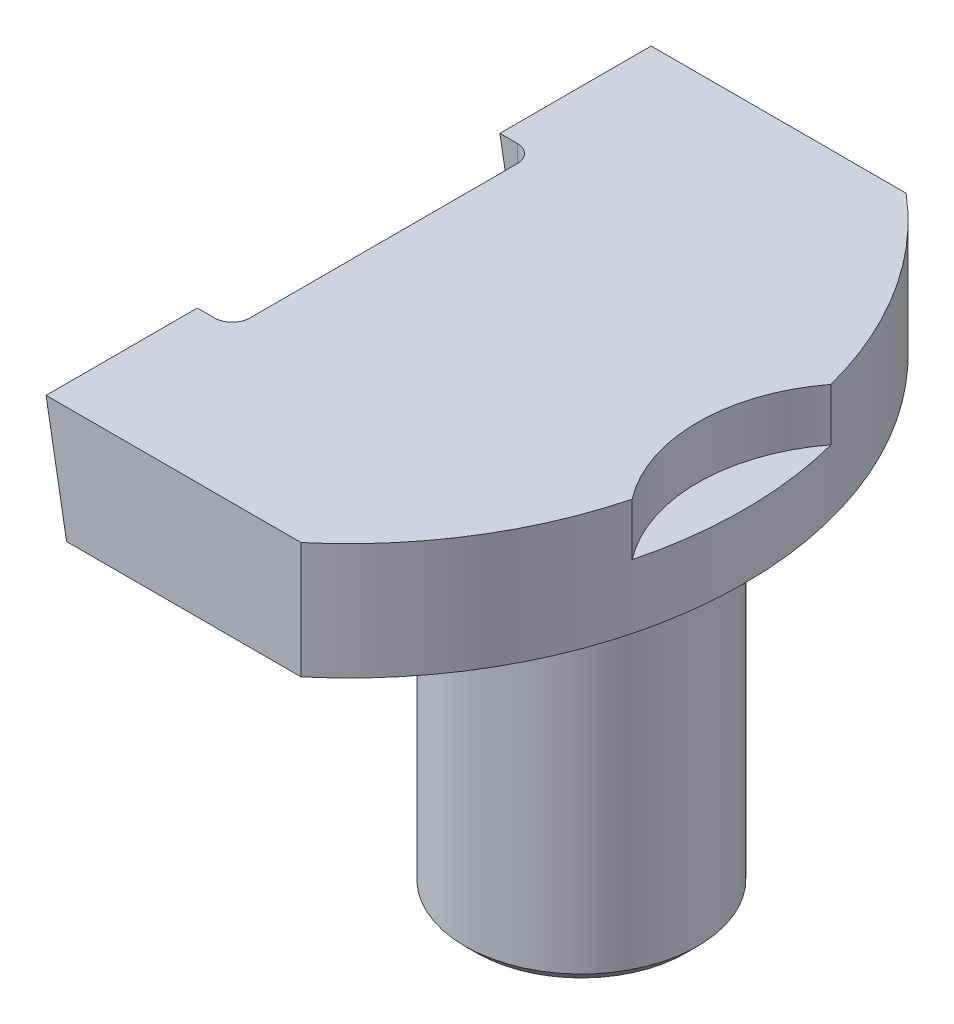
from build123d import *

# Parameters (mm, degrees)
SKETCH_1_R               = 10
EXTRUDE_1_DEPTH          = 40
CHAMFER_1_SIZE           = 1
EXTRUDE_2_DEPTH          = 10
SKETCH_3_R               = 14
CUT_EXTRUDE_1_DEPTH      = 4.5
CUT_EXTRUDE_2_DEPTH      = 69.585712798
CUT_EXTRUDE_2_DEPTH_BACK = 69.585712798
SKETCH_5_OUTSIDE_W       = 50.778
SKETCH_5_OUTSIDE_H       = 68.778
SKETCH_5_OUTSIDE_R       = 9.5
CUT_EXTRUDE_3_DEPTH      = 2
FILLET_1_R               = 1.5


with BuildPart() as part:
    # 草图1 → 凸台-拉伸1 (new body)
    with BuildSketch(Plane(origin=(0, 0, 0), x_dir=(1, 0, 0), z_dir=(0, 1, 0))):
        with Locations(Location((0, 0, 0), (0, 0, 270))):
            Circle(SKETCH_1_R)
    extrude(amount=EXTRUDE_1_DEPTH)

    # 倒角1
    chamfer_1_edges = [part.edges().sort_by_distance(p)[0] for p in [
        (0, 0, -10),
    ]]
    chamfer(chamfer_1_edges, length=CHAMFER_1_SIZE)

    # 草图2 → 凸台-拉伸2 (add)
    with BuildSketch(Plane(origin=(0, 40, 0), x_dir=(1, 0, 0), z_dir=(0, 1, 0))):
        with BuildLine():
            Line((-17, -13), (-17, 13))
            Line((-17, 13), (-20, 13))
            Line((-20, 13), (-20, 26))
            Line((-20, 26), (1.9089023, 26))
            ThreePointArc((1.9089023, 26), (14, 0), (1.9089023, -26))
            Line((1.9089023, -26), (-20, -26))
            Line((-20, -26), (-20, -13))
            Line((-20, -13), (-17, -13))
        make_face()
    extrude(amount=-EXTRUDE_2_DEPTH)

    # 草图3 → 切除-拉伸1 (cut)
    with BuildSketch(Plane(origin=(0, 40, 0), x_dir=(1, 0, 0), z_dir=(0, 1, 0))):
        with Locations((24, 0)):
            Circle(SKETCH_3_R)
    extrude(amount=-CUT_EXTRUDE_1_DEPTH, mode=Mode.SUBTRACT)

    # 草图4 → 切除-拉伸2 (cut, two sides: drawn at the far end of the back side and taken through both)
    with BuildSketch(Plane.XY.offset(26).offset(-CUT_EXTRUDE_2_DEPTH_BACK)):
        Polygon((-39.968713517, 153.248201929), (-20, 40), (-18.236730193, 30), (1.731983324, -83.248201929), (-224.764420535, -123.185628963), (-266.465117376, 113.310774896), align=None)
    extrude(amount=CUT_EXTRUDE_2_DEPTH + CUT_EXTRUDE_2_DEPTH_BACK, mode=Mode.SUBTRACT)

    # 草图5 outside → 切除-拉伸3 (cut)
    with BuildSketch(Plane.XZ.offset(-30)):
        with Locations((-3, 0)):
            Rectangle(SKETCH_5_OUTSIDE_W, SKETCH_5_OUTSIDE_H)
        with Locations(Location((0, 0, 0), (0, 0, 270))):
            Circle(SKETCH_5_OUTSIDE_R, mode=Mode.SUBTRACT)
    extrude(amount=CUT_EXTRUDE_3_DEPTH, mode=Mode.SUBTRACT)

    # 圆角1
    fillet_1_edges = [part.edges().sort_by_distance(p)[0] for p in [
        (-17, 35, 13),
        (-17, 35, -13),
    ]]
    fillet(fillet_1_edges, radius=FILLET_1_R)


solid = part.part
